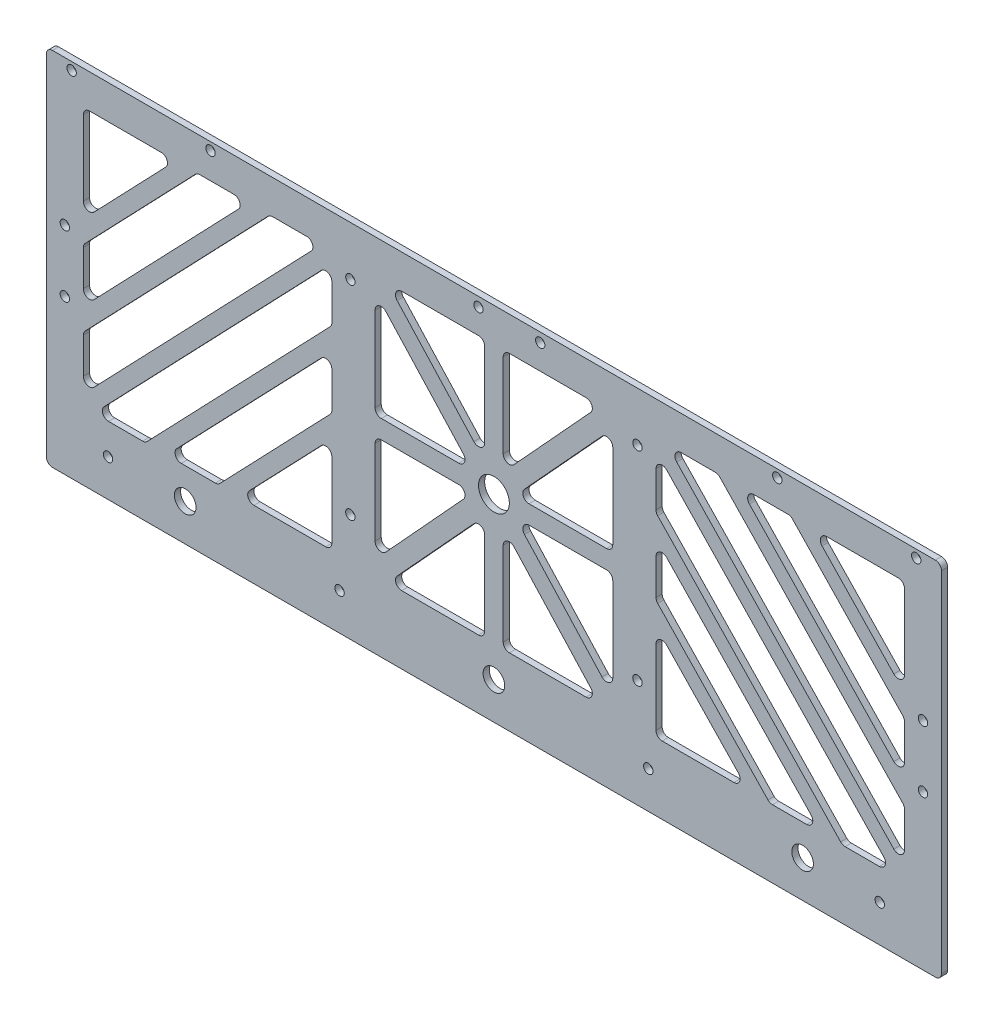
from build123d import *

# Parameters (mm, degrees)
SKETCH_1_W          = 290
SKETCH_1_H          = 117
EXTRUDE_1_DEPTH     = 1
SKETCH_2_R          = 1.525
CUT_EXTRUDE_1_DEPTH = 10
SKETCH_3_R          = 3.5
CUT_EXTRUDE_2_DEPTH = 10
SKETCH_4_R          = 1.525
CUT_EXTRUDE_3_DEPTH = 10
SKETCH_5_R          = 1.525
CUT_EXTRUDE_4_DEPTH = 10
FILLET_1_R          = 2
SKETCH_6_R          = 1.5
CUT_EXTRUDE_5_DEPTH = 10
SKETCH_7_R          = 1.525
CUT_EXTRUDE_6_DEPTH = 10
CUT_EXTRUDE_7_DEPTH = 10
FILLET_2_R          = 2
SKETCH_9_R          = 5
CUT_EXTRUDE_8_DEPTH = 10
CUT_EXTRUDE_9_DEPTH = 10
FILLET_3_R          = 2


with BuildPart() as part:
    # 草图1 → 凸台-拉伸1 (new, symmetric)
    with BuildSketch(Plane.XY):
        Rectangle(SKETCH_1_W, SKETCH_1_H)
    extrude(amount=EXTRUDE_1_DEPTH, both=True)

    # 草图2 → 切除-拉伸1 (cut)
    with BuildSketch(Plane(origin=(0, 0, -1), x_dir=(-1, 0, 0), z_dir=(0, 0, -1))):
        with Locations((91.8, 55.999993227)):
            Circle(SKETCH_2_R)
        with Locations((136.8, 55.999993227)):
            Circle(SKETCH_2_R)
    cut_extrude_1 = extrude(amount=-CUT_EXTRUDE_1_DEPTH, mode=Mode.SUBTRACT)

    # 镜向1: 切除-拉伸1 across plane
    add(cut_extrude_1.mirror(Plane(origin=(0, 0, 0), x_dir=(0, 0, 1), z_dir=(1, 0, 0))), mode=Mode.SUBTRACT)

    # 草图3 → 切除-拉伸2 (cut)
    with BuildSketch(Plane(origin=(0, 0, -1), x_dir=(-1, 0, 0), z_dir=(0, 0, -1))):
        with Locations((100, -46.5)):
            Circle(SKETCH_3_R)
        with Locations((0, -46.5)):
            Circle(SKETCH_3_R)
        with Locations((-100, -46.5)):
            Circle(SKETCH_3_R)
    extrude(amount=-CUT_EXTRUDE_2_DEPTH, mode=Mode.SUBTRACT)

    # 草图4 → 切除-拉伸3 (cut)
    with BuildSketch(Plane(origin=(0, 0, -1), x_dir=(-1, 0, 0), z_dir=(0, 0, -1))):
        with Locations((-50, -46.5)):
            Circle(SKETCH_4_R)
        with Locations((50, -46.5)):
            Circle(SKETCH_4_R)
        with Locations((-125, -46.5)):
            Circle(SKETCH_4_R)
        with Locations((125, -46.5)):
            Circle(SKETCH_4_R)
    extrude(amount=-CUT_EXTRUDE_3_DEPTH, mode=Mode.SUBTRACT)

    # 草图5 → 切除-拉伸4 (cut)
    with BuildSketch(Plane(origin=(0, 0, -1), x_dir=(-1, 0, 0), z_dir=(0, 0, -1))):
        with Locations((139, 11.5)):
            Circle(SKETCH_5_R)
        with Locations((139, -8.5)):
            Circle(SKETCH_5_R)
    cut_extrude_4 = extrude(amount=-CUT_EXTRUDE_4_DEPTH, mode=Mode.SUBTRACT)

    # 镜向2: 切除-拉伸4 across plane
    add(cut_extrude_4.mirror(Plane(origin=(0, 0, 0), x_dir=(0, 0, 1), z_dir=(1, 0, 0))), mode=Mode.SUBTRACT)

    # 圆角1
    fillet_1_edges = [part.edges().sort_by_distance(p)[0] for p in [
        (145, -58.5, 0),
        (-145, -58.5, 0),
        (-145, 58.5, 0),
        (145, 58.5, 0),
    ]]
    fillet(fillet_1_edges, radius=FILLET_1_R)

    # 草图6 → 切除-拉伸5 (cut)
    with BuildSketch(Plane(origin=(0, 0, -1), x_dir=(-1, 0, 0), z_dir=(0, 0, -1))):
        with Locations((-15, 55.5)):
            Circle(SKETCH_6_R)
        with Locations((5, 55.5)):
            Circle(SKETCH_6_R)
    extrude(amount=-CUT_EXTRUDE_5_DEPTH, mode=Mode.SUBTRACT)

    # 草图7 → 切除-拉伸6 (cut)
    with BuildSketch(Plane(origin=(0, 0, -1), x_dir=(-1, 0, 0), z_dir=(0, 0, -1))):
        with Locations((-46.5, 42.5)):
            Circle(SKETCH_7_R)
        with Locations((-46.5, -23.5)):
            Circle(SKETCH_7_R)
    cut_extrude_6 = extrude(amount=-CUT_EXTRUDE_6_DEPTH, mode=Mode.SUBTRACT)

    # 镜向3: 切除-拉伸6 across plane
    add(cut_extrude_6.mirror(Plane(origin=(0, 0, 0), x_dir=(0, 0, 1), z_dir=(1, 0, 0))), mode=Mode.SUBTRACT)

    # 草图8 → 切除-拉伸7 (cut)
    with BuildSketch(Plane(origin=(0, 0, -1), x_dir=(-1, 0, 0), z_dir=(0, 0, -1))):
        Polygon((3, -2.212405617), (3, -36.5), (34.430294851, -36.5), align=None)
        Polygon((-3, -2.212405617), (-34.430294851, -36.5), (-3, -36.5), align=None)
        Polygon((-6.819705149, 2.5), (-38.5, 2.5), (-38.5, -32.060321656), align=None)
        Polygon((-38.5, 43.060321656), (-38.5, 8.5), (-6.819705149, 8.5), align=None)
        Polygon((-3, 47.5), (-34.430294851, 47.5), (-3, 13.212405617), align=None)
        Polygon((34.430294851, 47.5), (3, 47.5), (3, 13.212405617), align=None)
        Polygon((38.5, 43.060321656), (6.819705149, 8.5), (38.5, 8.5), align=None)
        Polygon((38.5, 2.5), (6.819705149, 2.5), (38.5, -32.060321656), align=None)
    extrude(amount=-CUT_EXTRUDE_7_DEPTH, mode=Mode.SUBTRACT)

    # 圆角2
    fillet_2_edges = [part.edges().sort_by_distance(p)[0] for p in [
        (-6.819705149, 2.5, 0),
        (-38.5, 2.5, 0),
        (-38.5, -32.060321656, 0),
        (-3, 47.5, 0),
        (-34.430294851, 47.5, 0),
        (-3, 13.212405617, 0),
        (-6.819705149, 8.5, 0),
        (-38.5, 43.060321656, 0),
        (-38.5, 8.5, 0),
        (38.5, 8.5, 0),
        (38.5, 43.060321656, 0),
        (6.819705149, 8.5, 0),
        (34.430294851, 47.5, 0),
        (3, 47.5, 0),
        (3, 13.212405617, 0),
        (3, -2.212405617, 0),
        (3, -36.5, 0),
        (34.430294851, -36.5, 0),
        (38.5, 2.5, 0),
        (6.819705149, 2.5, 0),
        (38.5, -32.060321656, 0),
        (-3, -2.212405617, 0),
        (-34.430294851, -36.5, 0),
        (-3, -36.5, 0),
    ]]
    fillet(fillet_2_edges, radius=FILLET_2_R)

    # 草图9 → 切除-拉伸8 (cut)
    with BuildSketch(Plane(origin=(0, 0, -1), x_dir=(-1, 0, 0), z_dir=(0, 0, -1))):
        with Locations((0, 5.5)):
            Circle(SKETCH_9_R)
    extrude(amount=-CUT_EXTRUDE_8_DEPTH, mode=Mode.SUBTRACT)

    # 草图10 → 切除-拉伸9 (cut)
    with BuildSketch(Plane(origin=(0, 0, -1), x_dir=(-1, 0, 0), z_dir=(0, 0, -1))):
        Polygon((-52.5, -36.5), (-52.5, -5.252879136), (-82.445157495, -36.5), align=None)
        Polygon((-52.5, 1.973542664), (-52.5, 19.316954982), (-105.991248525, -36.5), (-89.370478386, -36.5), align=None)
        Polygon((-52.5, 26.543376782), (-52.5, 43.8867891), (-129.537339554, -36.5), (-112.916569416, -36.5), align=None)
        Polygon((-55.962660446, 47.5), (-72.583430584, 47.5), (-133, -15.543376782), (-133, -32.8867891), align=None)
        Polygon((-79.508751475, 47.5), (-96.129521614, 47.5), (-133, 9.026457336), (-133, -8.316954982), align=None)
        Polygon((-103.054842505, 47.5), (-133, 47.5), (-133, 16.252879136), align=None)
        Polygon((82.445157495, -36.5), (52.5, -5.252879136), (52.5, -36.5), align=None)
        Polygon((105.991248525, -36.5), (52.5, 19.316954982), (52.5, 1.973542664), (89.370478386, -36.5), align=None)
        Polygon((129.537339554, -36.5), (52.5, 43.8867891), (52.5, 26.543376782), (112.916569416, -36.5), align=None)
        Polygon((133, -15.543376782), (72.583430584, 47.5), (55.962660446, 47.5), (133, -32.8867891), align=None)
        Polygon((96.129521614, 47.5), (79.508751475, 47.5), (133, -8.316954982), (133, 9.026457336), align=None)
        Polygon((133, 47.5), (103.054842505, 47.5), (133, 16.252879136), align=None)
    extrude(amount=-CUT_EXTRUDE_9_DEPTH, mode=Mode.SUBTRACT)

    # 圆角3
    fillet_3_edges = [part.edges().sort_by_distance(p)[0] for p in [
        (103.054842505, 47.5, 0),
        (133, 16.252879136, 0),
        (133, 47.5, 0),
        (-82.445157495, -36.5, 0),
        (-52.5, -36.5, 0),
        (-52.5, -5.252879136, 0),
        (-129.537339554, -36.5, 0),
        (-112.916569416, -36.5, 0),
        (-52.5, 26.543376782, 0),
        (-52.5, 43.8867891, 0),
        (-105.991248525, -36.5, 0),
        (-89.370478386, -36.5, 0),
        (-52.5, 1.973542664, 0),
        (-52.5, 19.316954982, 0),
        (112.916569416, -36.5, 0),
        (129.537339554, -36.5, 0),
        (52.5, 43.8867891, 0),
        (52.5, 26.543376782, 0),
        (52.5, 1.973542664, 0),
        (89.370478386, -36.5, 0),
        (105.991248525, -36.5, 0),
        (52.5, 19.316954982, 0),
        (79.508751475, 47.5, 0),
        (133, -8.316954982, 0),
        (133, 9.026457336, 0),
        (96.129521614, 47.5, 0),
        (133, -15.543376782, 0),
        (72.583430584, 47.5, 0),
        (55.962660446, 47.5, 0),
        (133, -32.8867891, 0),
        (-133, 47.5, 0),
        (-133, 16.252879136, 0),
        (-103.054842505, 47.5, 0),
        (-72.583430584, 47.5, 0),
        (-133, -15.543376782, 0),
        (-133, -32.8867891, 0),
        (-55.962660446, 47.5, 0),
        (-96.129521614, 47.5, 0),
        (-133, 9.026457336, 0),
        (-133, -8.316954982, 0),
        (-79.508751475, 47.5, 0),
        (52.5, -5.252879136, 0),
        (52.5, -36.5, 0),
        (82.445157495, -36.5, 0),
    ]]
    fillet(fillet_3_edges, radius=FILLET_3_R)


solid = part.part
